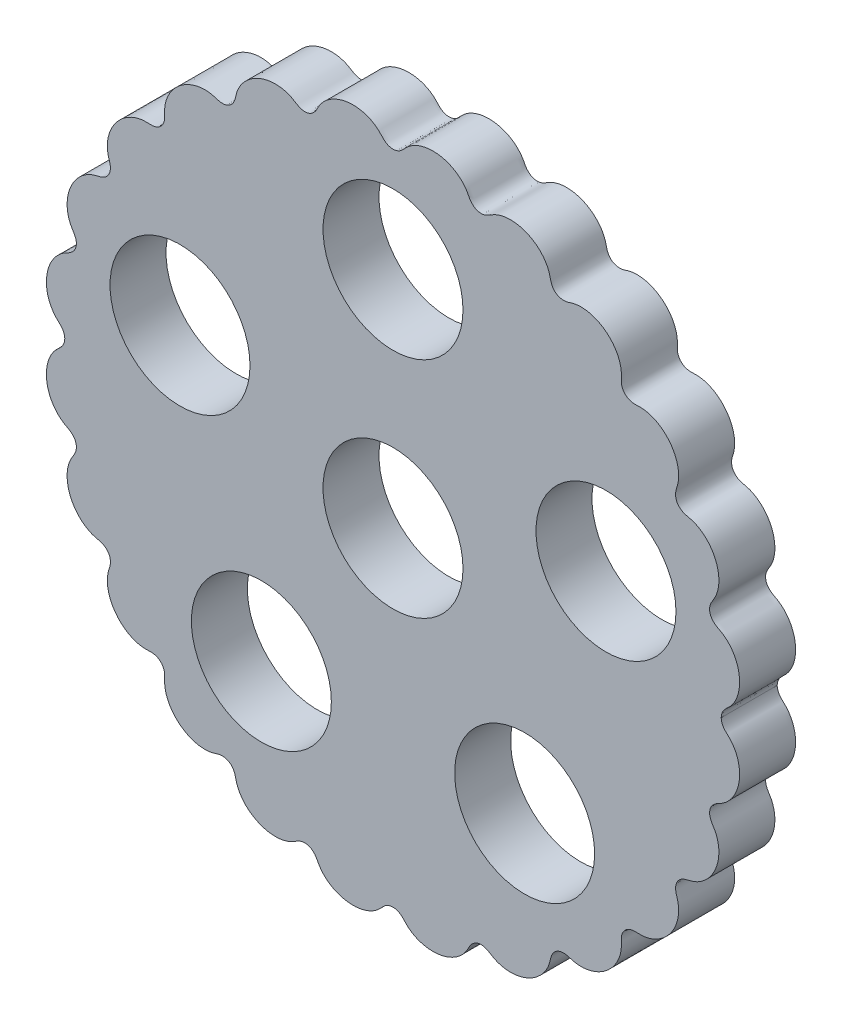
from build123d import *

# Parameters (mm, degrees)
BOSS_EXTRU_1_DEPTH      = 4
ESQUISSE2_R             = 5
ENL_V_MAT_EXTRU_1_DEPTH = 36.247658765


with BuildPart() as part:
    # Esquisse1 → Boss.-Extru.1 (new body)
    with BuildSketch(Plane.XY):
        with BuildLine():
            add(Edge.make_bspline(
                [(23.45, 0), (23.45, 0.168841476), (23.568005536, 0.527763251), (23.890341297, 0.816446156), (24.10128925, 1.022222973), (24.358748362, 1.346609284), (24.596377455, 1.806314234), (24.753315771, 2.41696401), (24.778292282, 3.048943212), (24.67447618, 3.673735015), (24.445067599, 4.262634577), (24.099013483, 4.786320193), (23.715454371, 5.137686338), (23.376888993, 5.353123943), (23.046363015, 5.498552418), (22.66194801, 5.878864223), (22.577572909, 6.427998455), (22.792489413, 6.881317255), (22.969563209, 7.135055625), (23.101927102, 7.414567792), (23.232291841, 7.803513514), (23.304006196, 8.320889193), (23.252067788, 8.949596982), (23.070670291, 9.556185922), (22.770014642, 10.113379858), (22.362160416, 10.594672731), (21.945676821, 10.909764317), (21.578354998, 11.092683756), (21.28722948, 11.196555377), (20.983859001, 11.250721932), (20.510157458, 11.419086997), (20.181254932, 11.868334019), (20.184132889, 12.406520163), (20.315411002, 12.746040831), (20.402051741, 13.135582001), (20.42508055, 13.6564502), (20.299390487, 14.2710568), (20.045214128, 14.849784622), (19.676825192, 15.364962533), (19.212290682, 15.79418852), (18.66950107, 16.115027575), (18.176443197, 16.272006949), (17.76490712, 16.319431877), (17.471477141, 16.315288105), (17.036330984, 16.29382817), (16.539941133, 16.539981391), (16.293870863, 17.036198115), (16.315125281, 17.471403467), (16.319498033, 17.764674544), (16.271968468, 18.176611595), (16.115037592, 18.669447273), (15.794186973, 19.212296305), (15.36498143, 19.676813547), (14.849778601, 20.045208501), (14.271140067, 20.299404206), (13.656165436, 20.425027521), (13.136411044, 20.402208089), (12.744863866, 20.315241116), (12.408033501, 20.184304675), (11.867416972, 20.181409648), (11.419526679, 20.510072158), (11.251000969, 20.982064149), (11.196827203, 21.287172697), (11.092522619, 21.57853292), (10.909894604, 21.945536743), (10.594635543, 22.362211734), (10.113371867, 22.77001257), (9.556177983, 23.070676157), (8.949585162, 23.252066528), (8.320907764, 23.304009558), (7.803401715, 23.232291608), (7.414670141, 23.101921636), (7.134997698, 22.969630559), (6.880967866, 22.792319066), (6.427957585, 22.577625427), (5.878873814, 22.661964853), (5.498691373, 23.046172899), (5.353383843, 23.376439276), (5.137566983, 23.715741482), (4.786357984, 24.098929844), (4.262606227, 24.445098123), (3.673732805, 24.674470145), (3.048938367, 24.778297049), (2.416946511, 24.75330554), (1.806307285, 24.596409099), (1.346567854, 24.358621164), (1.022273786, 24.101457605), (0.81703173, 23.890496611), (0.524345586, 23.567713644), (2.6986e-05, 23.391075612), (-0.52444443, 23.567854548), (-0.818373993, 23.890980744), (-1.021153047, 24.100722619), (-1.34739724, 24.359174465), (-1.806087439, 24.596247614), (-2.417037234, 24.753357595), (-3.048924541, 24.778285463), (-3.673734116, 24.674471838), (-4.262608042, 24.445097172), (-4.786359409, 24.098928994), (-5.137568028, 23.715741115), (-5.353384078, 23.376438303), (-5.498691236, 23.046173168), (-5.878873808, 22.661964793), (-6.427957629, 22.577625445), (-6.880967854, 22.792319047), (-7.134997685, 22.969630562), (-7.414670153, 23.101921636), (-7.803401704, 23.232291608), (-8.320907767, 23.304009558), (-8.949585162, 23.252066528), (-9.556177984, 23.070676157), (-10.113371868, 22.770012569), (-10.594635543, 22.362211734), (-10.909894606, 21.945536742), (-11.092522618, 21.578532921), (-11.196827205, 21.287172695), (-11.251000969, 20.982064147), (-11.419526674, 20.510072163), (-11.867416977, 20.181409647), (-12.408033517, 20.184304656), (-12.744863719, 20.315241123), (-13.136411272, 20.402208091), (-13.656165658, 20.425027397), (-14.271139832, 20.29940429), (-14.849779039, 20.045207663), (-15.364980657, 19.676814968), (-15.794186174, 19.212297001), (-16.115037981, 18.669447391), (-16.271968868, 18.176611466), (-16.319497759, 17.764674535), (-16.315125454, 17.471403767), (-16.293870849, 17.036197962), (-16.539941143, 16.539981423), (-17.036330974, 16.293828167), (-17.471477057, 16.315288121), (-17.764907374, 16.319431917), (-18.176443026, 16.272006835), (-18.669501162, 16.115027502), (-19.212290202, 15.794188337), (-19.676824994, 15.364964454), (-20.045213006, 14.849782073), (-20.299393678, 14.271072338), (-20.425066548, 13.65639861), (-20.402095786, 13.135741654), (-20.315360078, 12.745809403), (-20.184125808, 12.406835669), (-20.181396295, 11.867991628), (-20.509718167, 11.419733878), (-20.982711281, 11.250958467), (-21.287408351, 11.196702118), (-21.578470727, 11.092537543), (-21.945544198, 10.909901216), (-22.362196892, 10.594645953), (-22.770009331, 10.113379973), (-23.070672458, 9.55618368), (-23.252065556, 8.949600731), (-23.304006475, 8.320889638), (-23.232292769, 7.803515221), (-23.101926385, 7.414566348), (-22.969563459, 7.135056557), (-22.792489554, 6.881317298), (-22.577572884, 6.427998447), (-22.661948023, 5.878864216), (-23.046362996, 5.498552433), (-23.376889011, 5.35312393), (-23.715454351, 5.13768635), (-24.099013492, 4.786320205), (-24.445067544, 4.262634569), (-24.67447627, 3.673735199), (-24.778291719, 3.04894304), (-24.753318049, 2.416965399), (-24.596370332, 1.806307282), (-24.358768614, 1.346620324), (-24.101246073, 1.022183679), (-23.89049265, 0.816644048), (-23.567723446, 0.527364742), (-23.45, 0.168757938), (-23.45, 0)],
                knots=[0.075303121, 0.075303121, 0.075303121, 0.075303121, 0.078621066, 0.081939011, 0.085256955, 0.0885749, 0.095210789, 0.101846679, 0.108482568, 0.115118457, 0.121754346, 0.128390236, 0.135026125, 0.13834407, 0.141662014, 0.144979959, 0.148297904, 0.151615848, 0.154933793, 0.158251737, 0.161569682, 0.168205571, 0.174841461, 0.18147735, 0.188113239, 0.194749129, 0.201385018, 0.204702962, 0.208020907, 0.211338852, 0.214656796, 0.217974741, 0.221292686, 0.22461063, 0.227928575, 0.234564464, 0.241200354, 0.247836243, 0.254472132, 0.261108021, 0.267743911, 0.2743798, 0.277697745, 0.281015689, 0.284333634, 0.287651579, 0.290969523, 0.294287468, 0.297605412, 0.300923357, 0.307559246, 0.314195136, 0.320831025, 0.327466914, 0.334102804, 0.340738693, 0.347374582, 0.350692527, 0.354010471, 0.357328416, 0.360646361, 0.363964305, 0.36728225, 0.370600195, 0.373918139, 0.380554029, 0.387189918, 0.393825807, 0.400461696, 0.407097586, 0.413733475, 0.41705142, 0.420369364, 0.423687309, 0.427005254, 0.430323198, 0.433641143, 0.436959087, 0.440277032, 0.446912921, 0.453548811, 0.4601847, 0.466820589, 0.473456478, 0.480092368, 0.486728257, 0.490046202, 0.493364146, 0.496682091, 0.500000036, 0.50331798, 0.506635925, 0.50995387, 0.513271814, 0.519907703, 0.526543593, 0.533179482, 0.539815371, 0.546451261, 0.55308715, 0.559723039, 0.563040984, 0.566358928, 0.569676873, 0.572994818, 0.576312762, 0.579630707, 0.582948652, 0.586266596, 0.592902486, 0.599538375, 0.606174264, 0.612810153, 0.619446043, 0.626081932, 0.629399877, 0.632717821, 0.636035766, 0.639353711, 0.642671655, 0.6459896, 0.649307545, 0.652625489, 0.659261378, 0.665897268, 0.672533157, 0.679169046, 0.685804936, 0.692440825, 0.699076714, 0.702394659, 0.705712603, 0.709030548, 0.712348493, 0.715666437, 0.718984382, 0.722302327, 0.725620271, 0.732256161, 0.73889205, 0.745527939, 0.752163828, 0.758799718, 0.765435607, 0.772071496, 0.775389441, 0.778707386, 0.78202533, 0.785343275, 0.78866122, 0.791979164, 0.795297109, 0.798615053, 0.805250943, 0.811886832, 0.818522721, 0.825158611, 0.8317945, 0.838430389, 0.841748334, 0.845066278, 0.848384223, 0.851702168, 0.855020112, 0.858338057, 0.861656002, 0.864973946, 0.871609836, 0.878245725, 0.884881614, 0.891517503, 0.898153393, 0.904789282, 0.911425171, 0.914743116, 0.918061061, 0.921379005, 0.92469695, 0.92469695, 0.92469695, 0.92469695], degree=3))
            add(Edge.make_bspline(
                [(-23.45, 0), (-23.45, -0.168757938), (-23.567723446, -0.527364742), (-23.89049265, -0.816644048), (-24.101246073, -1.022183679), (-24.358768614, -1.346620324), (-24.596370332, -1.806307282), (-24.753318049, -2.416965399), (-24.778291719, -3.04894304), (-24.67447627, -3.673735199), (-24.445067544, -4.262634569), (-24.099013492, -4.786320205), (-23.715454351, -5.13768635), (-23.376889011, -5.35312393), (-23.046362996, -5.498552433), (-22.661948023, -5.878864216), (-22.577572884, -6.427998447), (-22.792489554, -6.881317298), (-22.969563459, -7.135056557), (-23.101926385, -7.414566348), (-23.232292769, -7.803515221), (-23.304006475, -8.320889638), (-23.252065556, -8.949600731), (-23.070672458, -9.55618368), (-22.770009331, -10.113379973), (-22.362196892, -10.594645953), (-21.945544198, -10.909901216), (-21.578470727, -11.092537543), (-21.287408351, -11.196702118), (-20.982711281, -11.250958467), (-20.509718167, -11.419733878), (-20.181396295, -11.867991628), (-20.184125808, -12.406835669), (-20.315360078, -12.745809403), (-20.402095786, -13.135741654), (-20.425066548, -13.65639861), (-20.299393678, -14.271072338), (-20.045213006, -14.849782073), (-19.676824994, -15.364964454), (-19.212290202, -15.794188337), (-18.669501162, -16.115027502), (-18.176443026, -16.272006835), (-17.764907374, -16.319431917), (-17.471477057, -16.315288121), (-17.036330974, -16.293828167), (-16.539941143, -16.539981423), (-16.293870849, -17.036197962), (-16.315125454, -17.471403767), (-16.319497759, -17.764674535), (-16.271968868, -18.176611466), (-16.115037981, -18.669447391), (-15.794186174, -19.212297001), (-15.364980657, -19.676814968), (-14.849779039, -20.045207663), (-14.271139832, -20.29940429), (-13.656165658, -20.425027397), (-13.136411272, -20.402208091), (-12.744863719, -20.315241123), (-12.408033517, -20.184304656), (-11.867416977, -20.181409647), (-11.419526674, -20.510072163), (-11.251000969, -20.982064147), (-11.196827205, -21.287172695), (-11.092522618, -21.578532921), (-10.909894606, -21.945536742), (-10.594635543, -22.362211734), (-10.113371868, -22.770012569), (-9.556177984, -23.070676157), (-8.949585162, -23.252066528), (-8.320907767, -23.304009558), (-7.803401704, -23.232291608), (-7.414670153, -23.101921636), (-7.134997685, -22.969630562), (-6.880967854, -22.792319047), (-6.427957629, -22.577625445), (-5.878873808, -22.661964793), (-5.498691236, -23.046173168), (-5.353384078, -23.376438303), (-5.137568028, -23.715741115), (-4.786359409, -24.098928994), (-4.262608042, -24.445097172), (-3.673734116, -24.674471838), (-3.048924541, -24.778285463), (-2.417037234, -24.753357595), (-1.806087439, -24.596247614), (-1.34739724, -24.359174465), (-1.021153047, -24.100722619), (-0.818373993, -23.890980744), (-0.52444443, -23.567854548), (2.6986e-05, -23.391075612), (0.524345586, -23.567713644), (0.81703173, -23.890496611), (1.022273786, -24.101457605), (1.346567854, -24.358621164), (1.806307285, -24.596409099), (2.416946511, -24.75330554), (3.048938367, -24.778297049), (3.673732805, -24.674470145), (4.262606227, -24.445098123), (4.786357984, -24.098929844), (5.137566983, -23.715741482), (5.353383843, -23.376439276), (5.498691373, -23.046172899), (5.878873814, -22.661964853), (6.427957585, -22.577625427), (6.880967866, -22.792319066), (7.134997698, -22.969630559), (7.414670141, -23.101921636), (7.803401715, -23.232291608), (8.320907764, -23.304009558), (8.949585162, -23.252066528), (9.556177983, -23.070676157), (10.113371867, -22.77001257), (10.594635543, -22.362211734), (10.909894604, -21.945536743), (11.092522619, -21.57853292), (11.196827203, -21.287172697), (11.251000969, -20.982064149), (11.419526679, -20.510072158), (11.867416972, -20.181409648), (12.408033501, -20.184304675), (12.744863866, -20.315241116), (13.136411044, -20.402208089), (13.656165436, -20.425027521), (14.271140067, -20.299404206), (14.849778601, -20.045208501), (15.36498143, -19.676813547), (15.794186973, -19.212296305), (16.115037592, -18.669447273), (16.271968468, -18.176611595), (16.319498033, -17.764674544), (16.315125281, -17.471403467), (16.293870863, -17.036198115), (16.539941133, -16.539981391), (17.036330984, -16.29382817), (17.471477141, -16.315288105), (17.76490712, -16.319431877), (18.176443197, -16.272006949), (18.66950107, -16.115027575), (19.212290682, -15.79418852), (19.676825192, -15.364962533), (20.045214128, -14.849784622), (20.299390487, -14.2710568), (20.42508055, -13.6564502), (20.402051741, -13.135582001), (20.315411002, -12.746040831), (20.184132889, -12.406520163), (20.181254932, -11.868334019), (20.510157458, -11.419086997), (20.983859001, -11.250721932), (21.28722948, -11.196555377), (21.578354998, -11.092683756), (21.945676821, -10.909764317), (22.362160416, -10.594672731), (22.770014642, -10.113379858), (23.070670291, -9.556185922), (23.252067788, -8.949596982), (23.304006196, -8.320889193), (23.232291841, -7.803513514), (23.101927102, -7.414567792), (22.969563209, -7.135055625), (22.792489413, -6.881317255), (22.577572909, -6.427998455), (22.66194801, -5.878864223), (23.046363015, -5.498552418), (23.376888993, -5.353123943), (23.715454371, -5.137686338), (24.099013483, -4.786320193), (24.445067599, -4.262634577), (24.67447618, -3.673735015), (24.778292282, -3.048943212), (24.753315771, -2.41696401), (24.596377455, -1.806314234), (24.358748362, -1.346609284), (24.10128925, -1.022222972), (23.890341297, -0.816446156), (23.568005536, -0.527763251), (23.45, -0.168841476), (23.45, 0)],
                knots=[0.075303121, 0.075303121, 0.075303121, 0.075303121, 0.078621066, 0.081939011, 0.085256955, 0.0885749, 0.095210789, 0.101846679, 0.108482568, 0.115118457, 0.121754346, 0.128390236, 0.135026125, 0.13834407, 0.141662014, 0.144979959, 0.148297904, 0.151615848, 0.154933793, 0.158251737, 0.161569682, 0.168205571, 0.174841461, 0.18147735, 0.188113239, 0.194749129, 0.201385018, 0.204702962, 0.208020907, 0.211338852, 0.214656796, 0.217974741, 0.221292686, 0.22461063, 0.227928575, 0.234564464, 0.241200354, 0.247836243, 0.254472132, 0.261108021, 0.267743911, 0.2743798, 0.277697745, 0.281015689, 0.284333634, 0.287651579, 0.290969523, 0.294287468, 0.297605412, 0.300923357, 0.307559246, 0.314195136, 0.320831025, 0.327466914, 0.334102804, 0.340738693, 0.347374582, 0.350692527, 0.354010471, 0.357328416, 0.360646361, 0.363964305, 0.36728225, 0.370600195, 0.373918139, 0.380554029, 0.387189918, 0.393825807, 0.400461696, 0.407097586, 0.413733475, 0.41705142, 0.420369364, 0.423687309, 0.427005254, 0.430323198, 0.433641143, 0.436959087, 0.440277032, 0.446912921, 0.453548811, 0.4601847, 0.466820589, 0.473456478, 0.480092368, 0.486728257, 0.490046202, 0.493364146, 0.496682091, 0.500000036, 0.50331798, 0.506635925, 0.50995387, 0.513271814, 0.519907703, 0.526543593, 0.533179482, 0.539815371, 0.546451261, 0.55308715, 0.559723039, 0.563040984, 0.566358928, 0.569676873, 0.572994818, 0.576312762, 0.579630707, 0.582948652, 0.586266596, 0.592902486, 0.599538375, 0.606174264, 0.612810153, 0.619446043, 0.626081932, 0.629399877, 0.632717821, 0.636035766, 0.639353711, 0.642671655, 0.6459896, 0.649307545, 0.652625489, 0.659261378, 0.665897268, 0.672533157, 0.679169046, 0.685804936, 0.692440825, 0.699076714, 0.702394659, 0.705712603, 0.709030548, 0.712348493, 0.715666437, 0.718984382, 0.722302327, 0.725620271, 0.732256161, 0.73889205, 0.745527939, 0.752163828, 0.758799718, 0.765435607, 0.772071496, 0.775389441, 0.778707386, 0.78202533, 0.785343275, 0.78866122, 0.791979164, 0.795297109, 0.798615053, 0.805250943, 0.811886832, 0.818522721, 0.825158611, 0.8317945, 0.838430389, 0.841748334, 0.845066278, 0.848384223, 0.851702168, 0.855020112, 0.858338057, 0.861656002, 0.864973946, 0.871609836, 0.878245725, 0.884881614, 0.891517503, 0.898153393, 0.904789282, 0.911425171, 0.914743116, 0.918061061, 0.921379005, 0.92469695, 0.92469695, 0.92469695, 0.92469695], degree=3))
        make_face()
    extrude(amount=BOSS_EXTRU_1_DEPTH)

    # Esquisse2 → Enlèv. mat.-Extru.1 (cut, through all)
    with BuildSketch(Plane.XY.offset(4)):
        Circle(ESQUISSE2_R)
        with Locations((0, 16)):
            Circle(ESQUISSE2_R)
        with Locations((15.216904261, 4.94427191)):
            Circle(ESQUISSE2_R)
        with Locations((9.404564037, -12.94427191)):
            Circle(ESQUISSE2_R)
        with Locations((-9.404564037, -12.94427191)):
            Circle(ESQUISSE2_R)
        with Locations((-15.216904261, 4.94427191)):
            Circle(ESQUISSE2_R)
    extrude(amount=-ENL_V_MAT_EXTRU_1_DEPTH, mode=Mode.SUBTRACT)


solid = part.part
